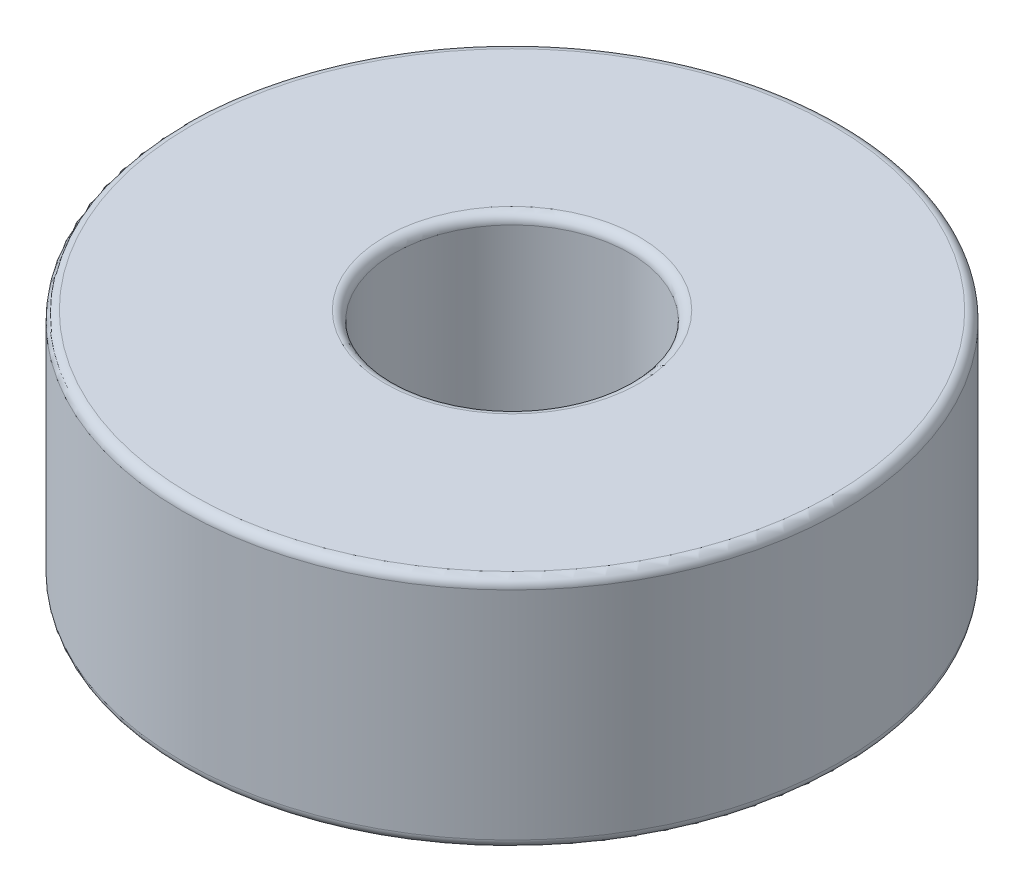
from build123d import *

# Parameters (mm, degrees)
SKETCH1_R           = 7
SKETCH1_R_2         = 2.5
BOSS_EXTRUDE1_DEPTH = 2.5
FILLET1_R           = 0.2


with BuildPart() as part:
    # Sketch1 → Boss-Extrude1 (new, symmetric)
    with BuildSketch(Plane(origin=(0, 0, 0), x_dir=(1, 0, 0), z_dir=(0, 1, 0))):
        with Locations(Location((0, 0, 0), (0, 0, 270))):
            Circle(SKETCH1_R)
        with Locations(Location((0, 0, 0), (0, 0, 270))):
            Circle(SKETCH1_R_2, mode=Mode.SUBTRACT)
    extrude(amount=BOSS_EXTRUDE1_DEPTH, both=True)

    # Fillet1
    fillet1_edges = [part.edges().sort_by_distance(p)[0] for p in [
        (0, -2.5, -7),
        (0, 2.5, -7),
        (0, -2.5, -2.5),
        (0, 2.5, -2.5),
    ]]
    fillet(fillet1_edges, radius=FILLET1_R)


solid = part.part
